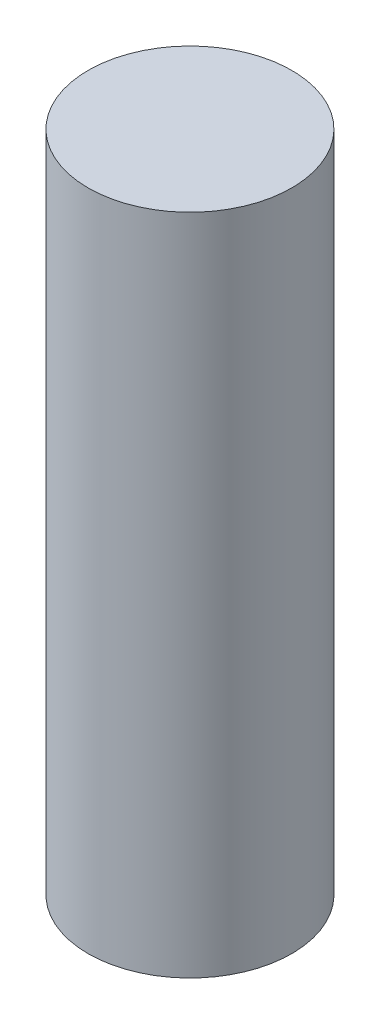
from build123d import *

# Parameters (mm, degrees)
SKETCH1_R           = 4
BOSS_EXTRUDE1_DEPTH = 26.05


with BuildPart() as part:
    # Sketch1 → Boss-Extrude1 (new body)
    with BuildSketch(Plane(origin=(0, 0, 0), x_dir=(1, 0, 0), z_dir=(0, 1, 0))):
        with Locations(Location((0, 0, 0), (0, 0, 270))):
            Circle(SKETCH1_R)
    extrude(amount=BOSS_EXTRUDE1_DEPTH)


solid = part.part
